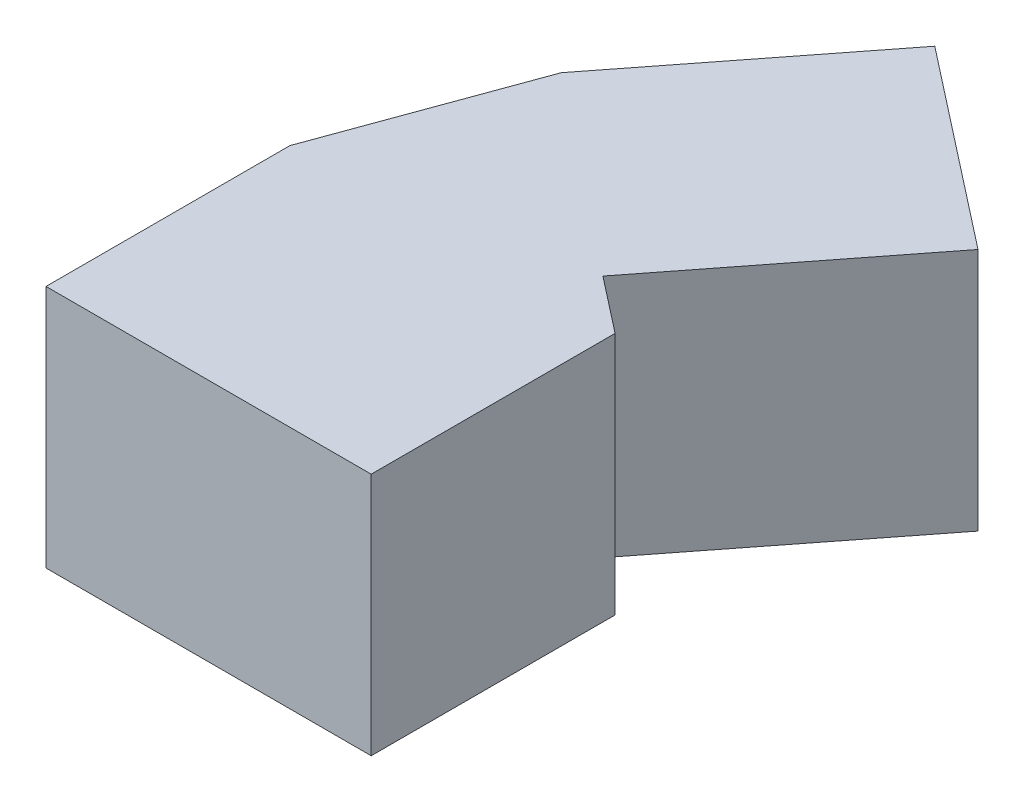
from build123d import *

# Parameters (mm, degrees)
EXTRUDE_1_DEPTH = 18


with BuildPart() as part:
    # 草图1 → 凸台-拉伸1 (new body)
    with BuildSketch(Plane(origin=(0, 0, 0), x_dir=(1, 0, 0), z_dir=(0, 1, 0))):
        Polygon((0, 0), (24, 0), (24, 18), (19.887980444, 21.212661775), (32.030145957, 36.753924921), (17.443530181, 48.150238166), (5.354693286, 32.677232538), (0, 18), align=None)
    extrude(amount=EXTRUDE_1_DEPTH)


solid = part.part
